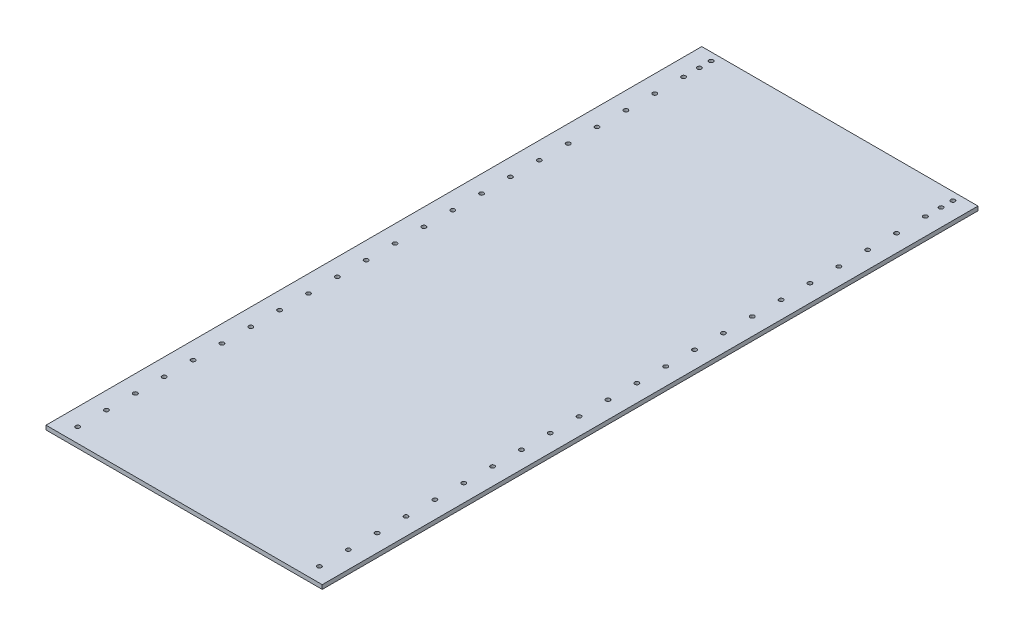
from build123d import *

# Parameters (mm, degrees)
SKETCH1_W           = 210.61
SKETCH1_H           = 500
SKETCH1_R           = 1.6
BOSS_EXTRUDE1_DEPTH = 3.175


with BuildPart() as part:
    # Sketch1 → Boss-Extrude1 (new body)
    with BuildSketch(Plane(origin=(0, 0, 0), x_dir=(1, 0, 0), z_dir=(0, 1, 0))):
        Rectangle(SKETCH1_W, SKETCH1_H)
        with Locations(Location((92.18, 244, 0), (0, 0, 270))):
            Circle(SKETCH1_R, mode=Mode.SUBTRACT)
        with Locations(Location((92.18, 235, 0), (0, 0, 270))):
            Circle(SKETCH1_R, mode=Mode.SUBTRACT)
        with Locations(Location((92.18, 223, 0), (0, 0, 270))):
            Circle(SKETCH1_R, mode=Mode.SUBTRACT)
        with Locations(Location((92.18, 201, 0), (0, 0, 270))):
            Circle(SKETCH1_R, mode=Mode.SUBTRACT)
        with Locations(Location((92.18, 179, 0), (0, 0, 270))):
            Circle(SKETCH1_R, mode=Mode.SUBTRACT)
        with Locations(Location((92.18, 157, 0), (0, 0, 270))):
            Circle(SKETCH1_R, mode=Mode.SUBTRACT)
        with Locations(Location((92.18, 135, 0), (0, 0, 270))):
            Circle(SKETCH1_R, mode=Mode.SUBTRACT)
        with Locations(Location((92.18, 113, 0), (0, 0, 270))):
            Circle(SKETCH1_R, mode=Mode.SUBTRACT)
        with Locations(Location((92.18, 91, 0), (0, 0, 270))):
            Circle(SKETCH1_R, mode=Mode.SUBTRACT)
        with Locations(Location((92.18, 69, 0), (0, 0, 270))):
            Circle(SKETCH1_R, mode=Mode.SUBTRACT)
        with Locations(Location((92.18, 47, 0), (0, 0, 270))):
            Circle(SKETCH1_R, mode=Mode.SUBTRACT)
        with Locations(Location((92.18, 25, 0), (0, 0, 270))):
            Circle(SKETCH1_R, mode=Mode.SUBTRACT)
        with Locations(Location((92.18, 3, 0), (0, 0, 270))):
            Circle(SKETCH1_R, mode=Mode.SUBTRACT)
        with Locations(Location((92.18, -19, 0), (0, 0, 270))):
            Circle(SKETCH1_R, mode=Mode.SUBTRACT)
        with Locations(Location((92.18, -41, 0), (0, 0, 270))):
            Circle(SKETCH1_R, mode=Mode.SUBTRACT)
        with Locations(Location((92.18, -63, 0), (0, 0, 270))):
            Circle(SKETCH1_R, mode=Mode.SUBTRACT)
        with Locations(Location((92.18, -85, 0), (0, 0, 270))):
            Circle(SKETCH1_R, mode=Mode.SUBTRACT)
        with Locations(Location((92.18, -107, 0), (0, 0, 270))):
            Circle(SKETCH1_R, mode=Mode.SUBTRACT)
        with Locations(Location((92.18, -129, 0), (0, 0, 270))):
            Circle(SKETCH1_R, mode=Mode.SUBTRACT)
        with Locations(Location((92.18, -151, 0), (0, 0, 270))):
            Circle(SKETCH1_R, mode=Mode.SUBTRACT)
        with Locations(Location((92.18, -173, 0), (0, 0, 270))):
            Circle(SKETCH1_R, mode=Mode.SUBTRACT)
        with Locations(Location((92.18, -195, 0), (0, 0, 270))):
            Circle(SKETCH1_R, mode=Mode.SUBTRACT)
        with Locations(Location((92.18, -217, 0), (0, 0, 270))):
            Circle(SKETCH1_R, mode=Mode.SUBTRACT)
        with Locations(Location((92.18, -239, 0), (0, 0, 270))):
            Circle(SKETCH1_R, mode=Mode.SUBTRACT)
        with Locations(Location((-92.18, 69, 0), (0, 0, 90))):
            Circle(SKETCH1_R, mode=Mode.SUBTRACT)
        with Locations(Location((-92.18, 91, 0), (0, 0, 90))):
            Circle(SKETCH1_R, mode=Mode.SUBTRACT)
        with Locations(Location((-92.18, 113, 0), (0, 0, 90))):
            Circle(SKETCH1_R, mode=Mode.SUBTRACT)
        with Locations(Location((-92.18, 135, 0), (0, 0, 90))):
            Circle(SKETCH1_R, mode=Mode.SUBTRACT)
        with Locations(Location((-92.18, 157, 0), (0, 0, 90))):
            Circle(SKETCH1_R, mode=Mode.SUBTRACT)
        with Locations(Location((-92.18, 179, 0), (0, 0, 90))):
            Circle(SKETCH1_R, mode=Mode.SUBTRACT)
        with Locations(Location((-92.18, 201, 0), (0, 0, 90))):
            Circle(SKETCH1_R, mode=Mode.SUBTRACT)
        with Locations(Location((-92.18, 223, 0), (0, 0, 90))):
            Circle(SKETCH1_R, mode=Mode.SUBTRACT)
        with Locations(Location((-92.18, 235, 0), (0, 0, 90))):
            Circle(SKETCH1_R, mode=Mode.SUBTRACT)
        with Locations(Location((-92.18, -239, 0), (0, 0, 90))):
            Circle(SKETCH1_R, mode=Mode.SUBTRACT)
        with Locations(Location((-92.18, -217, 0), (0, 0, 90))):
            Circle(SKETCH1_R, mode=Mode.SUBTRACT)
        with Locations(Location((-92.18, -195, 0), (0, 0, 90))):
            Circle(SKETCH1_R, mode=Mode.SUBTRACT)
        with Locations(Location((-92.18, -173, 0), (0, 0, 90))):
            Circle(SKETCH1_R, mode=Mode.SUBTRACT)
        with Locations(Location((-92.18, -151, 0), (0, 0, 90))):
            Circle(SKETCH1_R, mode=Mode.SUBTRACT)
        with Locations(Location((-92.18, -129, 0), (0, 0, 90))):
            Circle(SKETCH1_R, mode=Mode.SUBTRACT)
        with Locations(Location((-92.18, -107, 0), (0, 0, 90))):
            Circle(SKETCH1_R, mode=Mode.SUBTRACT)
        with Locations(Location((-92.18, -85, 0), (0, 0, 90))):
            Circle(SKETCH1_R, mode=Mode.SUBTRACT)
        with Locations(Location((-92.18, -63, 0), (0, 0, 90))):
            Circle(SKETCH1_R, mode=Mode.SUBTRACT)
        with Locations(Location((-92.18, -41, 0), (0, 0, 90))):
            Circle(SKETCH1_R, mode=Mode.SUBTRACT)
        with Locations(Location((-92.18, -19, 0), (0, 0, 90))):
            Circle(SKETCH1_R, mode=Mode.SUBTRACT)
        with Locations(Location((-92.18, 3, 0), (0, 0, 90))):
            Circle(SKETCH1_R, mode=Mode.SUBTRACT)
        with Locations(Location((-92.18, 25, 0), (0, 0, 90))):
            Circle(SKETCH1_R, mode=Mode.SUBTRACT)
        with Locations(Location((-92.18, 47, 0), (0, 0, 90))):
            Circle(SKETCH1_R, mode=Mode.SUBTRACT)
        with Locations(Location((-92.18, 244, 0), (0, 0, 90))):
            Circle(SKETCH1_R, mode=Mode.SUBTRACT)
    extrude(amount=BOSS_EXTRUDE1_DEPTH)


solid = part.part
